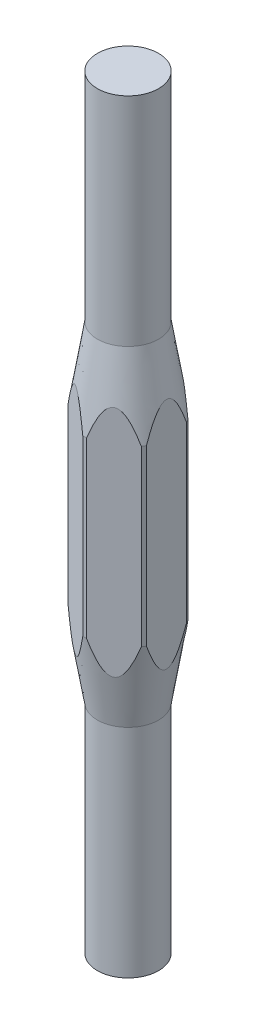
from build123d import *

# Parameters (mm, degrees)
SKETCH3_W                = 0.428843097
SKETCH3_H                = 18.90052945
CUT_EXTRUDE1_DEPTH       = 14.99883388
CIRPATTERN1_COUNT        = 6
BOSS_EXTRUDE1_DEPTH      = 27.94
BOSS_EXTRUDE1_DEPTH_BACK = 27.94
SKETCH5_R                = 2.237093308


with BuildPart() as part:
    # Sketch1 → Revolve1 (revolve)
    with BuildSketch(Plane.XY):
        Polygon((2.237093308, -12.065), (3.175, -6.35), (3.175, 6.35), (2.237093308, 12.065), align=None)
    revolve(axis=Axis((0, 6.041374164, 0), (0, -1, 0)))

    # Sketch3 → Cut-Extrude1 (cut, through all)
    with BuildSketch(Plane.XY.offset(3.175)):
        with Locations((-3.029889302, -0.659045193)):
            Rectangle(SKETCH3_W, SKETCH3_H)
    cut_extrude1 = extrude(amount=-CUT_EXTRUDE1_DEPTH, mode=Mode.SUBTRACT)

    # CirPattern1: Cut-Extrude1 ×6 about axis
    cirpattern1_axis = Axis((0, 6.041374164, 0), (0, 1, 0))
    for i in range(1, CIRPATTERN1_COUNT):
        add(cut_extrude1.rotate(cirpattern1_axis, i * 360 / CIRPATTERN1_COUNT), mode=Mode.SUBTRACT)

    # Sketch5 → Boss-Extrude1 (add, two sides: drawn at the far end of the back side and taken through both)
    with BuildSketch(Plane(origin=(0, 0, 0), x_dir=(1, 0, 0), z_dir=(0, 1, 0)).offset(-BOSS_EXTRUDE1_DEPTH_BACK)):
        Circle(SKETCH5_R)
    extrude(amount=BOSS_EXTRUDE1_DEPTH + BOSS_EXTRUDE1_DEPTH_BACK)


solid = part.part
